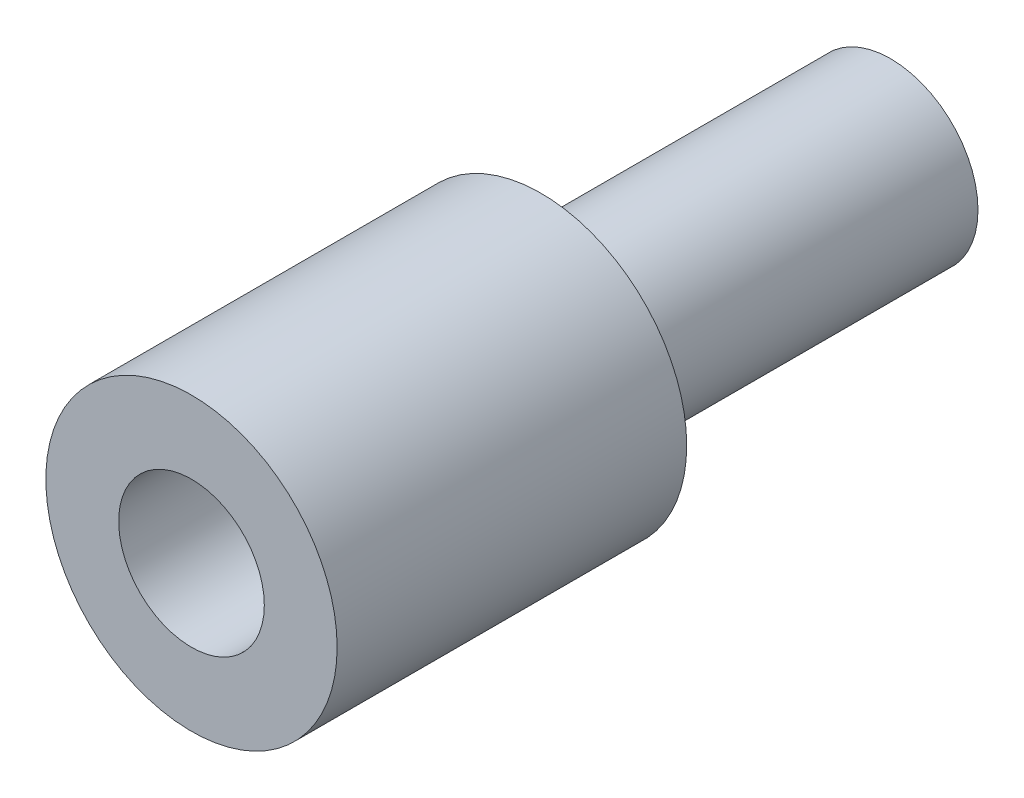
from build123d import *

# Parameters (mm, degrees)
SKETCH1_R           = 1.5
BOSS_EXTRUDE1_DEPTH = 6
SKETCH2_R           = 2.5
BOSS_EXTRUDE2_DEPTH = 6
SKETCH3_R           = 1.25
CUT_EXTRUDE1_DEPTH  = 6


with BuildPart() as part:
    # Sketch1 → Boss-Extrude1 (new body)
    with BuildSketch(Plane.XY):
        Circle(SKETCH1_R)
    extrude(amount=BOSS_EXTRUDE1_DEPTH)

    # Sketch2 → Boss-Extrude2 (add)
    with BuildSketch(Plane.XY.offset(6)):
        Circle(SKETCH2_R)
    extrude(amount=BOSS_EXTRUDE2_DEPTH)

    # Sketch3 → Cut-Extrude1 (cut)
    with BuildSketch(Plane.XY.offset(12)):
        Circle(SKETCH3_R)
    extrude(amount=-CUT_EXTRUDE1_DEPTH, mode=Mode.SUBTRACT)


solid = part.part
